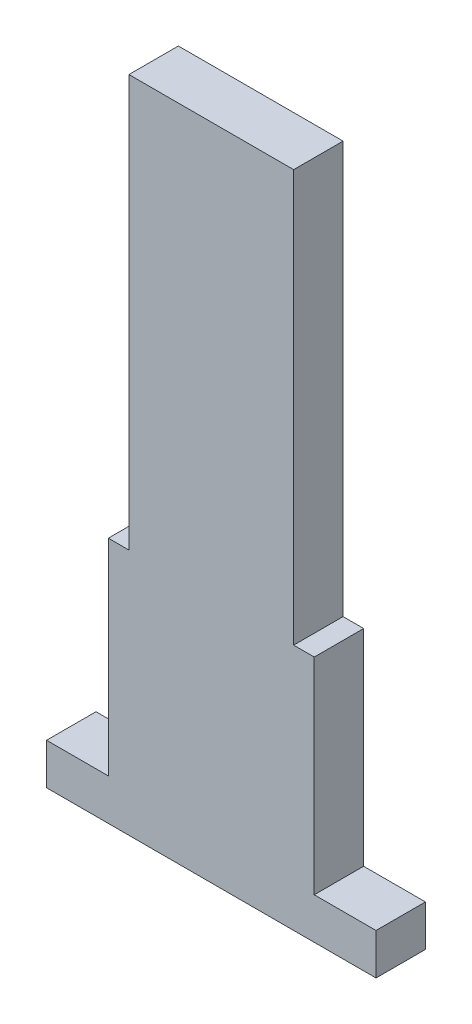
from build123d import *

# Parameters (mm, degrees)
BOSS_EXTRUDE1_DEPTH = 0.6


with BuildPart() as part:
    # Sketch1 → Boss-Extrude1 (new, symmetric)
    with BuildSketch(Plane.XY):
        Polygon((-2.5, 0), (-2.5, 5), (-2, 5), (-2, 15), (2, 15), (2, 5), (2.5, 5), (2.5, 0), (4, 0), (4, -1), (-4, -1), (-4, 0), align=None)
    extrude(amount=BOSS_EXTRUDE1_DEPTH, both=True)


solid = part.part
